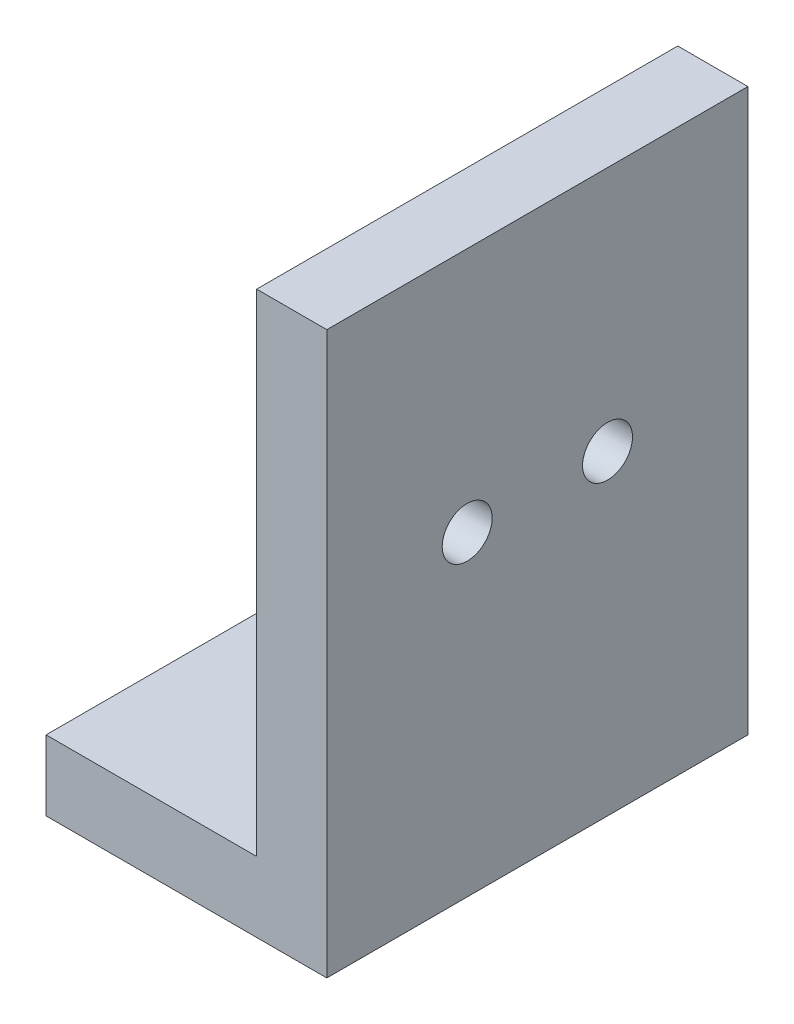
from build123d import *

# Parameters (mm, degrees)
BOSS_EXTRUDE1_DEPTH       = 19.05
F_4_40_TAPPED_HOLE1_D     = 2.2606
F_4_40_TAPPED_HOLE1_DEPTH = 7.5946
F_4_40_TAPPED_HOLE1_TIP   = 0.679152758
F_4_40_TAPPED_HOLE2_D     = 2.2606
F_4_40_TAPPED_HOLE2_DEPTH = 7.5946
F_4_40_TAPPED_HOLE2_TIP   = 0.679152758


with BuildPart() as part:
    # Sketch1 → Boss-Extrude1 (new body)
    with BuildSketch(Plane.XY):
        Polygon((0, 0), (12.7, 0), (12.7, 25.4), (9.525, 25.4), (9.525, 3.175), (0, 3.175), align=None)
    extrude(amount=BOSS_EXTRUDE1_DEPTH)

    # #4-40 Tapped Hole1
    with Locations(Plane.ZY.offset(-9.525)):
        with Locations((6.35, 14.2875), (12.7, 14.2875)):
            Hole(F_4_40_TAPPED_HOLE1_D / 2, depth=F_4_40_TAPPED_HOLE1_DEPTH)
            with Locations((0, 0, -(F_4_40_TAPPED_HOLE1_DEPTH + F_4_40_TAPPED_HOLE1_TIP / 2))):  # 118° drill point
                Cone(0, F_4_40_TAPPED_HOLE1_D / 2, F_4_40_TAPPED_HOLE1_TIP, mode=Mode.SUBTRACT)

    # #4-40 Tapped Hole2
    with Locations(Plane(origin=(0, 3.175, 0), x_dir=(1, 0, 0), z_dir=(0, 1, 0))):
        with Locations((4.7625, -6.35), (4.7625, -12.7)):
            Hole(F_4_40_TAPPED_HOLE2_D / 2, depth=F_4_40_TAPPED_HOLE2_DEPTH)
            with Locations((0, 0, -(F_4_40_TAPPED_HOLE2_DEPTH + F_4_40_TAPPED_HOLE2_TIP / 2))):  # 118° drill point
                Cone(0, F_4_40_TAPPED_HOLE2_D / 2, F_4_40_TAPPED_HOLE2_TIP, mode=Mode.SUBTRACT)


solid = part.part
